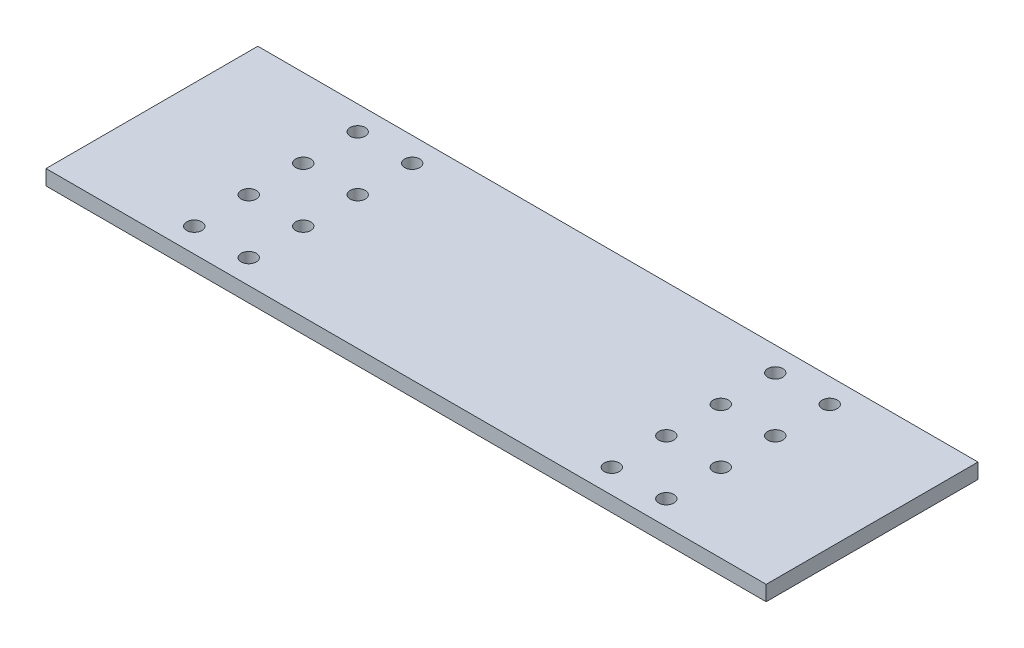
from build123d import *

# Parameters (mm, degrees)
SKETCH1_W           = 238
SKETCH1_H           = 70
SKETCH1_R           = 2.5
BOSS_EXTRUDE1_DEPTH = 5


with BuildPart() as part:
    # Sketch1 → Boss-Extrude1 (new body)
    with BuildSketch(Plane(origin=(0, 0, 0), x_dir=(1, 0, 0), z_dir=(0, 1, 0))):
        with Locations((119, 35)):
            Rectangle(SKETCH1_W, SKETCH1_H)
        with Locations(Location((41, 62, 0), (0, 0, 270))):
            Circle(SKETCH1_R, mode=Mode.SUBTRACT)
        with Locations(Location((59, 62, 0), (0, 0, 270))):
            Circle(SKETCH1_R, mode=Mode.SUBTRACT)
        with Locations(Location((41, 44, 0), (0, 0, 270))):
            Circle(SKETCH1_R, mode=Mode.SUBTRACT)
        with Locations(Location((59, 44, 0), (0, 0, 270))):
            Circle(SKETCH1_R, mode=Mode.SUBTRACT)
        with Locations(Location((197, 44, 0), (0, 0, 270))):
            Circle(SKETCH1_R, mode=Mode.SUBTRACT)
        with Locations(Location((197, 62, 0), (0, 0, 270))):
            Circle(SKETCH1_R, mode=Mode.SUBTRACT)
        with Locations(Location((179, 62, 0), (0, 0, 270))):
            Circle(SKETCH1_R, mode=Mode.SUBTRACT)
        with Locations(Location((179, 44, 0), (0, 0, 270))):
            Circle(SKETCH1_R, mode=Mode.SUBTRACT)
        with Locations(Location((197, 8, 0), (0, 0, 270))):
            Circle(SKETCH1_R, mode=Mode.SUBTRACT)
        with Locations(Location((197, 26, 0), (0, 0, 270))):
            Circle(SKETCH1_R, mode=Mode.SUBTRACT)
        with Locations(Location((179, 26, 0), (0, 0, 270))):
            Circle(SKETCH1_R, mode=Mode.SUBTRACT)
        with Locations(Location((179, 8, 0), (0, 0, 270))):
            Circle(SKETCH1_R, mode=Mode.SUBTRACT)
        with Locations(Location((59, 8, 0), (0, 0, 270))):
            Circle(SKETCH1_R, mode=Mode.SUBTRACT)
        with Locations(Location((59, 26, 0), (0, 0, 270))):
            Circle(SKETCH1_R, mode=Mode.SUBTRACT)
        with Locations(Location((41, 26, 0), (0, 0, 270))):
            Circle(SKETCH1_R, mode=Mode.SUBTRACT)
        with Locations(Location((41, 8, 0), (0, 0, 270))):
            Circle(SKETCH1_R, mode=Mode.SUBTRACT)
    extrude(amount=BOSS_EXTRUDE1_DEPTH)


solid = part.part
